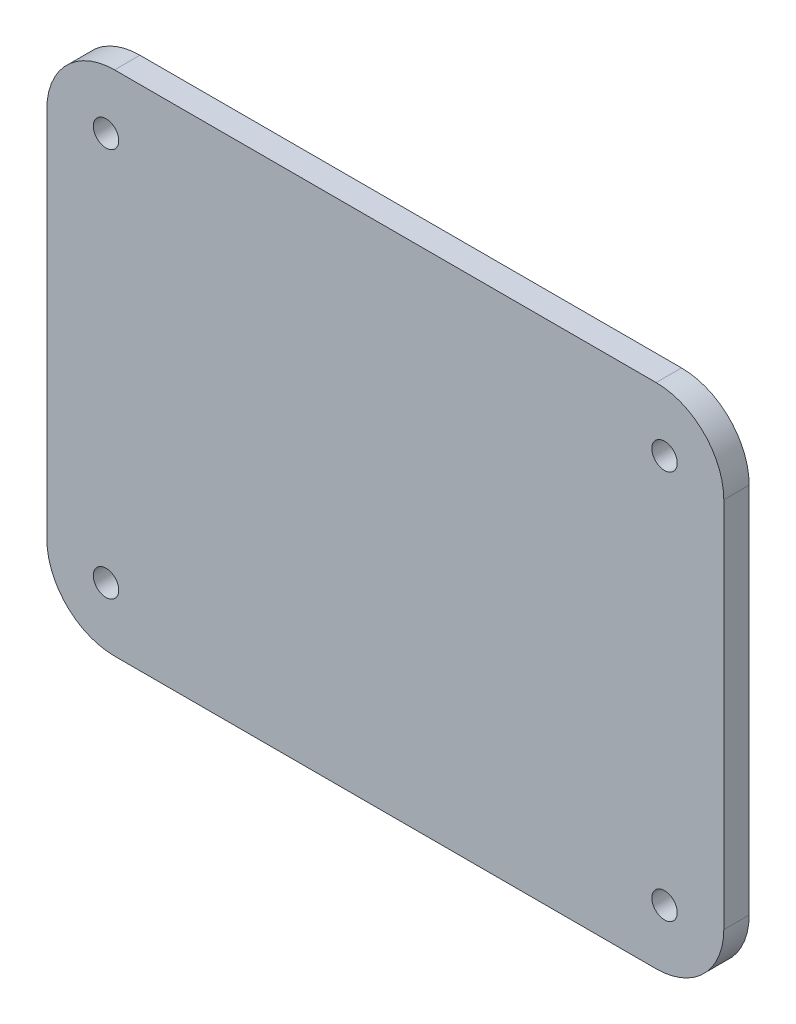
from build123d import *

# Parameters (mm, degrees)
SKETCH1_W           = 80
SKETCH1_H           = 60
BOSS_EXTRUDE1_DEPTH = 3
FILLET1_R           = 8
SKETCH2_R           = 1.5
CUT_EXTRUDE1_DEPTH  = 3


with BuildPart() as part:
    # Sketch1 → Boss-Extrude1 (new body)
    with BuildSketch(Plane.XY):
        Rectangle(SKETCH1_W, SKETCH1_H)
    extrude(amount=BOSS_EXTRUDE1_DEPTH)

    # Fillet1
    fillet1_edges = [part.edges().sort_by_distance(p)[0] for p in [
        (-40, 30, 1.5),
        (40, 30, 1.5),
        (40, -30, 1.5),
        (-40, -30, 1.5),
    ]]
    fillet(fillet1_edges, radius=FILLET1_R)

    # Sketch2 → Cut-Extrude1 (cut)
    with BuildSketch(Plane(origin=(0, 0, 0), x_dir=(-1, 0, 0), z_dir=(0, 0, -1))):
        with Locations((33, -23)):
            Circle(SKETCH2_R)
        with Locations((33, 23)):
            Circle(SKETCH2_R)
        with Locations((-33, 23)):
            Circle(SKETCH2_R)
        with Locations((-33, -23)):
            Circle(SKETCH2_R)
    extrude(amount=-CUT_EXTRUDE1_DEPTH, mode=Mode.SUBTRACT)


solid = part.part
